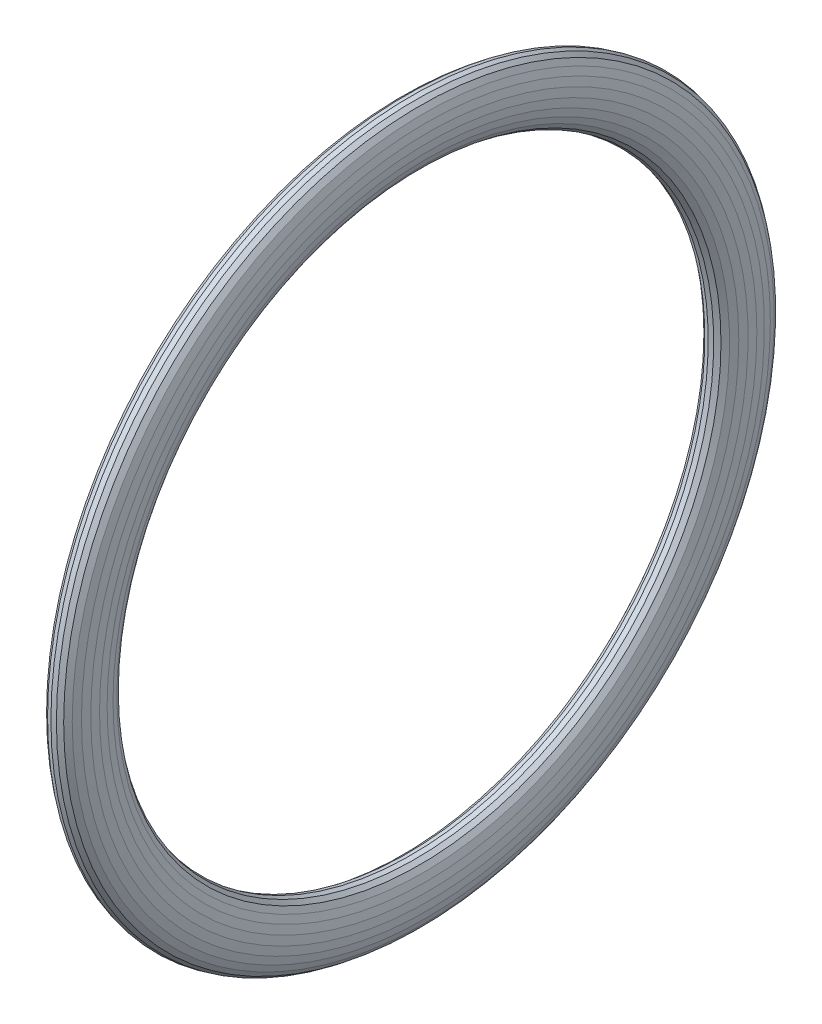
from build123d import *


with BuildPart() as part:
    # O_Ring_Pintle Sketch → O_Ring_Pintle (revolve)
    with BuildSketch(Plane.XY):
        Polygon((-1.295, 12.4), (-1.273022158, 12.707994664), (-1.208586385, 12.995), (-1.106083874, 13.24145707), (-0.9725, 13.430570231), (-0.816938284, 13.549451733), (-0.65, 13.59), (-0.483061716, 13.549451733), (-0.3275, 13.430570231), (-0.193916126, 13.24145707), (-0.091413615, 12.995), (-0.026977842, 12.707994664), (-0.005, 12.4), (-0.026977842, 12.092005336), (-0.091413615, 11.805), (-0.193916126, 11.55854293), (-0.3275, 11.369429769), (-0.483061716, 11.250548267), (-0.65, 11.21), (-0.816938284, 11.250548267), (-0.9725, 11.369429769), (-1.106083874, 11.55854293), (-1.208586385, 11.805), (-1.273022158, 12.092005336), align=None)
    revolve(axis=Axis((-1000, 0, 0), (1, 0, 0)))


solid = part.part
